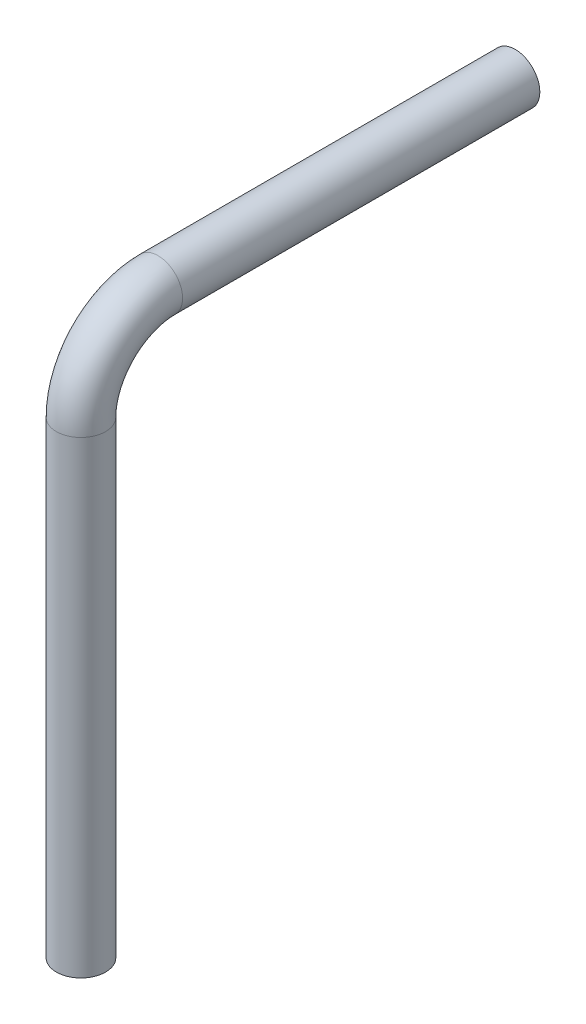
from build123d import *

# Parameters (mm, degrees)
SWEEP1_PROFILE_R                           = 8
HOLLOW_TUBE_OD_AND_WALL_PROVISIONAL_PROF_R = 6


with BuildPart() as part:
    # Sweep1: sweep along a curve in space
    with BuildLine() as sweep1_path:
        Line((0, 0, 0), (0, 152.000001606, 0))
        ThreePointArc((0, 152.000001606, 0), (0, 169.677670568, -7.322330568), (0, 177, -25))
        Line((0, 177, -25), (0, 177, -141))
    # Sweep1 profile (on start of the path) → Sweep1 (sweep)
    with BuildSketch(Plane.ZX):
        Circle(SWEEP1_PROFILE_R)
    sweep(path=sweep1_path.line)

    # Hollow_tube_OD_and_wall_PROVISIONAL: sweep along a curve in space
    with BuildLine() as hollow_tube_od_and_wall_provisional_path:
        Line((0, 0, 0), (0, 152.000001606, 0))
        ThreePointArc((0, 152.000001606, 0), (0, 169.677670568, -7.322330568), (0, 177, -25))
        Line((0, 177, -25), (0, 177, -141))
    # Hollow_tube_OD_and_wall_PROVISIONAL prof (on start of the path) → Hollow_tube_OD_and_wall_PROVISIONAL (sweep, cut)
    with BuildSketch(Plane.ZX):
        Circle(HOLLOW_TUBE_OD_AND_WALL_PROVISIONAL_PROF_R)
    sweep(path=hollow_tube_od_and_wall_provisional_path.line, mode=Mode.SUBTRACT)


solid = part.part
